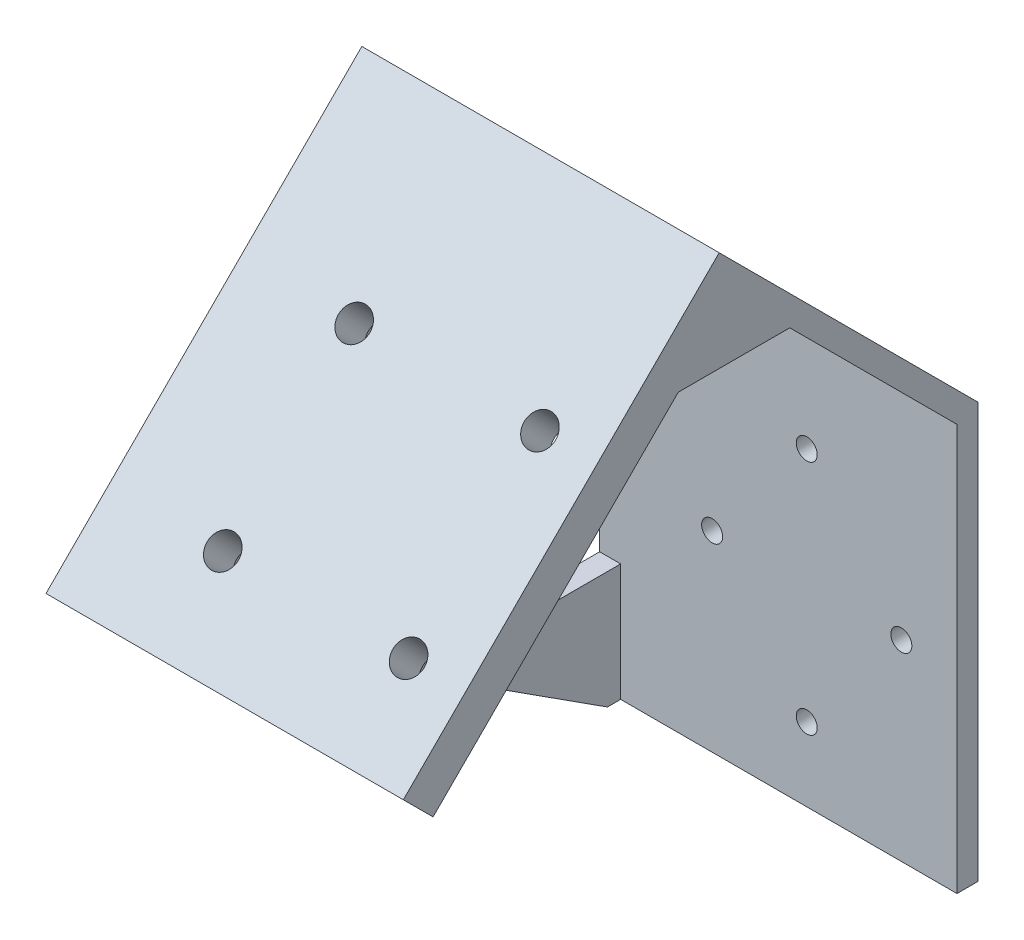
from build123d import *

# Parameters (mm, degrees)
BOSS_EXTRUDE1_DEPTH      = 37
BOSS_EXTRUDE1_DEPTH_BACK = 27
SKETCH2_R                = 2
CUT_EXTRUDE1_DEPTH       = 179.149132383
BOSS_EXTRUDE2_DEPTH      = 4
CHAMFER1_SIZE            = 15
SKETCH4_R                = 3
CUT_EXTRUDE7_DEPTH       = 20
CHAMFER2_SIZE            = 10


with BuildPart() as part:
    # Sketch1 → Boss-Extrude1 (new, two sides: drawn at the far end of the back side and taken through both)
    with BuildSketch(Plane(origin=(0, 0, 0), x_dir=(0, 0, -1), z_dir=(1, 0, 0)).offset(-BOSS_EXTRUDE1_DEPTH_BACK)):
        Polygon((22.304433561, 10.566780625), (22.304433561, 87.896140672), (-20.12197331, 130.322547544), (-77.397622586, 73.046898267), (-83.054476835, 78.703752517), (-22.950400434, 138.807828918), (26.304433561, 89.552994922), (26.304433561, 10.566780625), align=None)
    extrude(amount=BOSS_EXTRUDE1_DEPTH + BOSS_EXTRUDE1_DEPTH_BACK)

    # Sketch2 → Cut-Extrude1 (cut, through all)
    with BuildSketch(Plane.XY.offset(-22.304433561)):
        with Locations((8.41, 69.566780625)):
            Circle(SKETCH2_R)
        with Locations((26.41, 47.066780625)):
            Circle(SKETCH2_R)
        with Locations((8.41, 24.566780625)):
            Circle(SKETCH2_R)
        with Locations((-9.59, 47.066780625)):
            Circle(SKETCH2_R)
    extrude(amount=-CUT_EXTRUDE1_DEPTH, mode=Mode.SUBTRACT)

    # Sketch12 → Boss-Extrude2 (add)
    with BuildSketch(Plane.ZY.offset(27)):
        Polygon((-22.304433561, 10.566780625), (-19.7923121, 10.566780625), (77.397622586, 73.046898267), (20.12197331, 130.322547544), (-22.304433561, 87.896140672), (5.695566439, 87.896140672), (5.695566439, 32.896140672), (-22.304433561, 32.896140672), align=None)
        Polygon((-26.304433561, 89.552994922), (-26.304433561, 10.566780625), (-22.304433561, 10.566780625), (-22.304433561, 87.896140672), (20.12197331, 130.322547544), (77.397622586, 73.046898267), (83.054476835, 78.703752517), (22.950400434, 138.807828918), align=None)
    extrude(amount=BOSS_EXTRUDE2_DEPTH)

    # Chamfer1
    chamfer1_edges = [part.edges().sort_by_distance(p)[0] for p in [
        (5, 130.322547544, 20.12197331),
    ]]
    chamfer(chamfer1_edges, length=CHAMFER1_SIZE)

    # Sketch4 → Cut-Extrude7 (cut)
    with BuildSketch(Plane(origin=(0, 204.733202838, -42.974973485), x_dir=(1, 0, 0), z_dir=(0, -0.7071067811865472, -0.7071067811865478))):
        with Locations(Location((-9.26766953, 126.031352928, 0), (0, 0, 270))):
            Circle(SKETCH4_R)
        with Locations(Location((-9.26766953, 161.386691988, 0), (0, 0, 270))):
            Circle(SKETCH4_R)
        with Locations(Location((26.08766953, 161.386691988, 0), (0, 0, 270))):
            Circle(SKETCH4_R)
        with Locations(Location((26.08766953, 126.031352928, 0), (0, 0, 270))):
            Circle(SKETCH4_R)
    extrude(amount=CUT_EXTRUDE7_DEPTH, mode=Mode.SUBTRACT)

    # Chamfer2
    chamfer2_edges = [part.edges().sort_by_distance(p)[0] for p in [
        (-27, 96.381422047, 54.063098807),
    ]]
    chamfer(chamfer2_edges, length=CHAMFER2_SIZE)


solid = part.part
